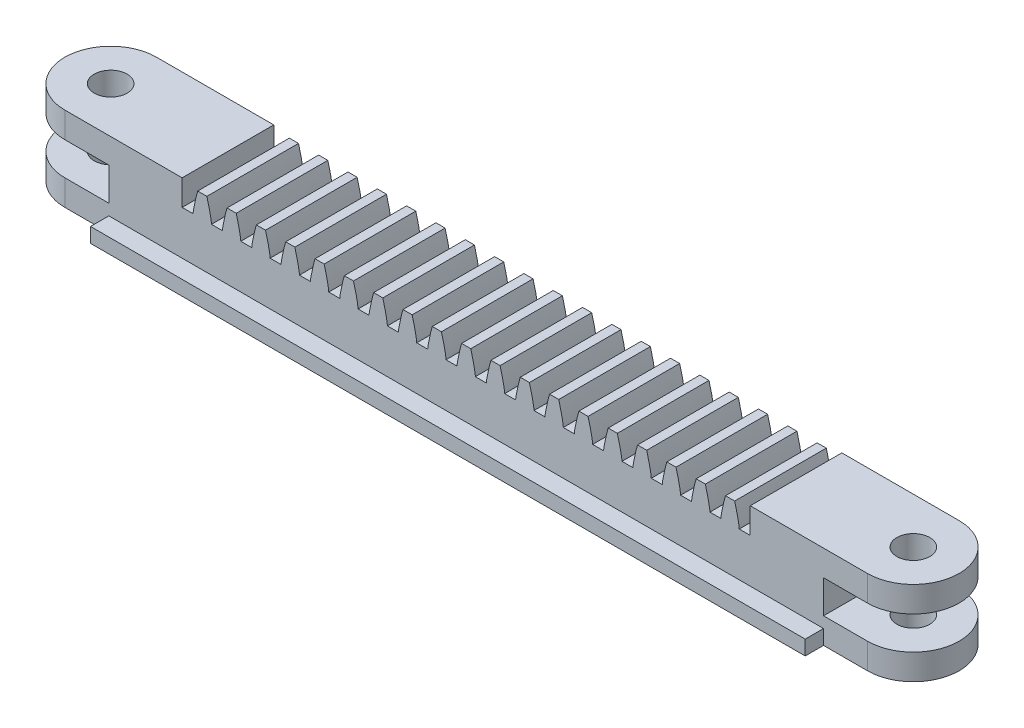
from build123d import *

# Parameters (mm, degrees)
SKETCH_1_W             = 195
SKETCH_1_H             = 16
EXTRUDE_1_DEPTH        = 25
EXTRUDE_2_DEPTH        = 25
PATTERN_LINEAR_1_COUNT = 10
PATTERN_LINEAR_1_PITCH = 8
PATTERN_LINEAR_2_COUNT = 10
PATTERN_LINEAR_2_PITCH = 8
SKETCH_3_W             = 195
SKETCH_3_H             = 4
EXTRUDE_3_DEPTH        = 5
SKETCH_5_W             = 195
SKETCH_5_H             = 4
EXTRUDE_4_DEPTH        = 5
SKETCH_6_W             = 20
SKETCH_6_H             = 25
EXTRUDE_5_DEPTH        = 7
EXTRUDE_6_DEPTH        = 7
EXTRUDE_START          = -7
EXTRUDE_7_DEPTH        = 7
SKETCH_9_R             = 4.5
CUT_EXTRUDE_1_DEPTH    = 50
SKETCH_10_R            = 4.5
CUT_EXTRUDE_2_DEPTH    = 50


with BuildPart() as part:
    # 草图1 → 凸台-拉伸1 (new body)
    with BuildSketch(Plane.XY):
        Rectangle(SKETCH_1_W, SKETCH_1_H)
    extrude(amount=EXTRUDE_1_DEPTH)

    # 草图2 → 凸台-拉伸2 (add)
    with BuildSketch(Plane.XY.offset(25)):
        with BuildLine():
            Line((-2.5, 8), (2.5, 8))
            add(Edge.make_bspline(
                [(2.5, 8), (2.5, 9.044984292), (1.579923026, 13.044978727), (1.25, 14)],
                knots=[0, 0, 0, 0, 0.806888018, 0.806888018, 0.806888018, 0.806888018], degree=3))
            Line((1.25, 14), (-1.25, 14))
            add(Edge.make_bspline(
                [(-2.5, 8), (-2.5, 9.044984292), (-1.579923026, 13.044978727), (-1.25, 14)],
                knots=[0, 0, 0, 0, 0.806888018, 0.806888018, 0.806888018, 0.806888018], degree=3))
        make_face()
    extrude_2 = extrude(amount=-EXTRUDE_2_DEPTH)

    # 阵列(线性)1: 凸台-拉伸2 ×10
    with Locations(*[(-i * PATTERN_LINEAR_1_PITCH, 0, 0) for i in range(1, PATTERN_LINEAR_1_COUNT)]):
        add(extrude_2)

    # 阵列(线性)2: 凸台-拉伸2 ×10
    with Locations(*[(i * PATTERN_LINEAR_2_PITCH, 0, 0) for i in range(1, PATTERN_LINEAR_2_COUNT)]):
        add(extrude_2)

    # 草图3 → 凸台-拉伸3 (add)
    with BuildSketch(Plane.XY.offset(25)):
        with Locations((0, -6)):
            Rectangle(SKETCH_3_W, SKETCH_3_H)
    extrude(amount=EXTRUDE_3_DEPTH)

    # 草图5 → 凸台-拉伸4 (add)
    with BuildSketch(Plane(origin=(0, 0, 0), x_dir=(-1, 0, 0), z_dir=(0, 0, -1))):
        with Locations((0, -6)):
            Rectangle(SKETCH_5_W, SKETCH_5_H)
    extrude(amount=EXTRUDE_4_DEPTH)

    # 草图6 → 凸台-拉伸5 (add)
    with BuildSketch(Plane(origin=(0, 8, 0), x_dir=(1, 0, 0), z_dir=(0, 1, 0))):
        with Locations((87.5, -12.5)):
            Rectangle(SKETCH_6_W, SKETCH_6_H)
    extrude_5 = extrude(amount=EXTRUDE_5_DEPTH)

    # 草图7 → 凸台-拉伸6 (add)
    with BuildSketch(Plane(origin=(0, 15, 0), x_dir=(1, 0, 0), z_dir=(0, 1, 0))):
        with BuildLine():
            Line((97.5, 0), (109.5, 0))
            ThreePointArc((109.5, 0), (122, -12.5), (109.5, -25))
            Line((109.5, -25), (97.5, -25))
            Line((97.5, -25), (97.5, 0))
        make_face()
    extrude_6 = extrude(amount=-EXTRUDE_6_DEPTH)

    # 镜向1: 凸台-拉伸5, 凸台-拉伸6 across plane
    add(extrude_5.mirror(Plane(origin=(0, 0, 0), x_dir=(0, 0, 1), z_dir=(1, 0, 0))))
    add(extrude_6.mirror(Plane(origin=(0, 0, 0), x_dir=(0, 0, 1), z_dir=(1, 0, 0))))

    # 草图8 → 凸台-拉伸7 (add)
    with BuildSketch(Plane.XZ.offset(8).offset(EXTRUDE_START)):
        with BuildLine():
            Line((97.5, 25), (97.5, 0))
            Line((97.5, 0), (109.5, 0))
            ThreePointArc((109.5, 0), (122, 12.5), (109.5, 25))
            Line((109.5, 25), (97.5, 25))
        make_face()
    extrude_7 = extrude(amount=EXTRUDE_7_DEPTH)

    # 镜向2: 凸台-拉伸7 across plane
    add(extrude_7.mirror(Plane(origin=(0, 0, 0), x_dir=(0, 0, 1), z_dir=(1, 0, 0))))

    # 草图9 → 切除-拉伸1 (cut)
    with BuildSketch(Plane(origin=(0, 15, 0), x_dir=(1, 0, 0), z_dir=(0, 1, 0))):
        with Locations((-109.5, -12.5)):
            Circle(SKETCH_9_R)
    extrude(amount=-CUT_EXTRUDE_1_DEPTH, mode=Mode.SUBTRACT)

    # 草图10 → 切除-拉伸2 (cut)
    with BuildSketch(Plane(origin=(0, 15, 0), x_dir=(1, 0, 0), z_dir=(0, 1, 0))):
        with Locations((109.5, -12.5)):
            Circle(SKETCH_10_R)
    extrude(amount=-CUT_EXTRUDE_2_DEPTH, mode=Mode.SUBTRACT)


solid = part.part
